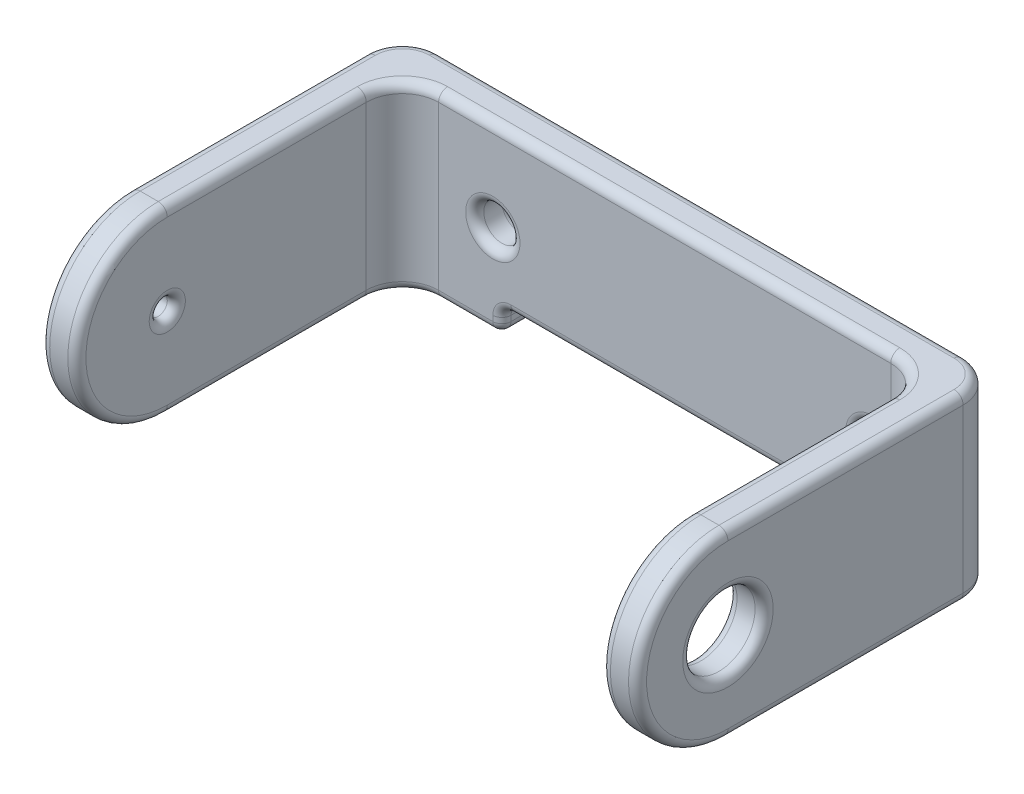
from build123d import *

# Parameters (mm, degrees)
ESQUISSE1_W             = 2
ESQUISSE1_H             = 10
BOSS_EXTRU_1_DEPTH      = 20
BOSS_EXTRU_1_2_DEPTH    = 20
BOSS_EXTRU_3_DEPTH      = 2
ENL_V_MAT_EXTRU_2_DEPTH = 50
CONG_1_R                = 2
ESQUISSE2_4_R           = 0.5
ENL_V_MAT_EXTRU_4_DEPTH = 10
CONG_2_R                = 2
ESQUISSE3_R             = 1
ENL_V_MAT_EXTRU_3_DEPTH = 10
CONG_3_R                = 0.5
ESQUISSE5_R             = 2
ENL_V_MAT_EXTRU_5_DEPTH = 10
CONG_4_R                = 0.5


with BuildPart() as part:
    # Esquisse1 → Boss.-Extru.1 (new body)
    with BuildSketch(Plane.XY):
        with Locations((-15.5, 0)):
            Rectangle(ESQUISSE1_W, ESQUISSE1_H)
    extrude(amount=BOSS_EXTRU_1_DEPTH)



with BuildPart() as body_2:
    # Esquisse1 → Boss.-Extru.1 2 (new body)
    with BuildSketch(Plane.XY):
        with Locations((15.5, 0)):
            Rectangle(ESQUISSE1_W, ESQUISSE1_H)
    extrude(amount=BOSS_EXTRU_1_2_DEPTH)


with BuildPart() as part_1:
    add(part.part)

    add(body_2.part)  # Boss.-Extru.3 merges body 2
    # Esquisse1<4> → Boss.-Extru.3 (add)
    with BuildSketch(Plane.XY):
        Polygon((14.5, 5), (-14.5, 5), (-14.5, -5), (-9, -5), (-9, -3.7), (11, -3.7), (11, -5), (14.5, -5), align=None)
    extrude(amount=BOSS_EXTRU_3_DEPTH)

    # Esquisse2 → Enlèv. mat.-Extru.2 (cut)
    with BuildSketch(Plane.ZY.offset(16.5)):
        with BuildLine():
            Line((20, 0), (20, 5))
            Line((20, 5), (15, 5))
            ThreePointArc((15, 5), (18.535533906, 3.535533906), (20, 0))
        make_face()
        with BuildLine():
            Line((20, -5), (20, 0))
            ThreePointArc((20, 0), (18.535533906, -3.535533906), (15, -5))
            Line((15, -5), (20, -5))
        make_face()
    extrude(amount=-ENL_V_MAT_EXTRU_2_DEPTH, mode=Mode.SUBTRACT)

    # Congé1
    cong_1_edges = [part_1.edges().sort_by_distance(p)[0] for p in [
        (-16.5, 0, 0),
    ]]
    fillet(cong_1_edges, radius=CONG_1_R)

    # Esquisse2<4> → Enlèv. mat.-Extru.4 (cut)
    with BuildSketch(Plane.ZY.offset(16.5)):
        with Locations((15, 0)):
            Circle(ESQUISSE2_4_R)
    extrude(amount=-ENL_V_MAT_EXTRU_4_DEPTH, mode=Mode.SUBTRACT)

    # Congé2
    cong_2_edges = [part_1.edges().sort_by_distance(p)[0] for p in [
        (16.5, 0, 0),
        (14.5, 0, 2),
        (-14.5, 0, 2),
    ]]
    fillet(cong_2_edges, radius=CONG_2_R)

    # Esquisse3 → Enlèv. mat.-Extru.3 (cut)
    with BuildSketch(Plane(origin=(0, 0, 0), x_dir=(-1, 0, 0), z_dir=(0, 0, -1))):
        with Locations((9.5, 0)):
            Circle(ESQUISSE3_R)
        with Locations((-11.5, 0)):
            Circle(ESQUISSE3_R)
    extrude(amount=-ENL_V_MAT_EXTRU_3_DEPTH, mode=Mode.SUBTRACT)

    # Congé3
    cong_3_edges = [part_1.edges().sort_by_distance(p)[0] for p in [
        (-16.5, 0, 20),
        (-16.5, 5, 8.5),
        (-15.914213562, 5, 0.585786438),
        (0, 5, 0),
        (15.914213562, 5, 0.585786438),
        (12.75, -5, 0),
        (-11.75, -5, 0),
        (15.914213562, -5, 0.585786438),
        (13.914213562, -5, 2.585786438),
        (16.5, 5, 8.5),
        (16.5, -5, 8.5),
        (16.5, 0, 20),
        (14.5, -5, 9.5),
        (14.5, 0, 20),
        (13.914213562, 5, 2.585786438),
        (14.5, 5, 9.5),
        (11.75, -5, 2),
        (-14.5, 0, 20),
        (-14.5, 5, 9.5),
        (-13.914213562, 5, 2.585786438),
        (0, 5, 2),
        (12.5, 0, 0),
        (11.5, 1, 2),
        (-8.5, 0, 0),
        (-8.5, 0, 2),
        (-15.914213562, -5, 0.585786438),
        (-16.5, -5, 8.5),
        (-10.75, -5, 2),
        (-13.914213562, -5, 2.585786438),
        (-14.5, -5, 9.5),
        (11, -4.35, 2),
        (11, -3.7, 1),
        (11, -5, 1),
        (11, -4.35, 0),
        (-9, -5, 1),
        (-9, -4.35, 0),
        (-9, -4.35, 2),
        (-9, -3.7, 1),
        (1, -3.7, 2),
        (1, -3.7, 0),
        (-14.5, 0, 14.5),
        (-16.5, 0, 14.5),
    ]]
    fillet(cong_3_edges, radius=CONG_3_R)

    # Esquisse5 → Enlèv. mat.-Extru.5 (cut)
    with BuildSketch(Plane(origin=(16.5, 0, 0), x_dir=(0, 0, -1), z_dir=(1, 0, 0))):
        with Locations((-15, 0)):
            Circle(ESQUISSE5_R)
    extrude(amount=-ENL_V_MAT_EXTRU_5_DEPTH, mode=Mode.SUBTRACT)

    # Congé4
    cong_4_edges = [part_1.edges().sort_by_distance(p)[0] for p in [
        (14.5, 0, 17),
        (16.5, 0, 17),
    ]]
    fillet(cong_4_edges, radius=CONG_4_R)


solid = part_1.part
